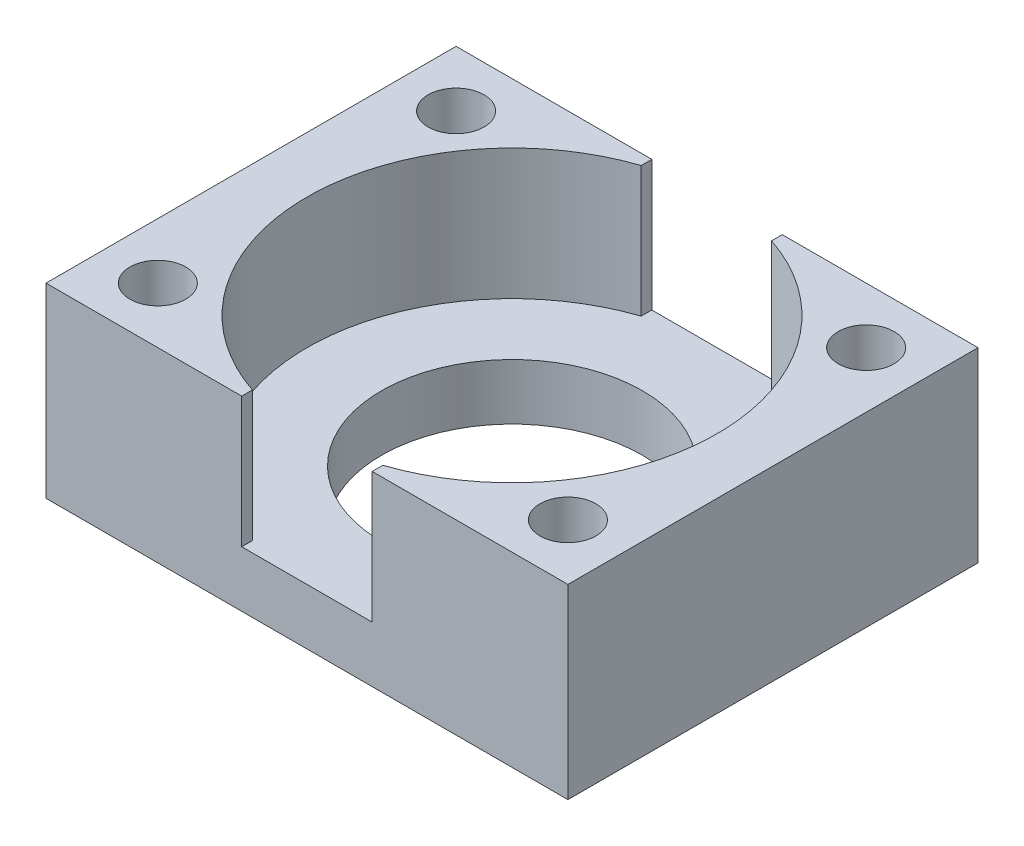
from build123d import *

# Parameters (mm, degrees)
SKETCH1_W           = 28
SKETCH1_H           = 22
BOSS_EXTRUDE1_DEPTH = 10
SKETCH5_W           = 7
SKETCH5_H           = 7
CUT_EXTRUDE7_DEPTH  = 22
SKETCH2_R           = 11
CUT_EXTRUDE8_DEPTH  = 7
SKETCH6_R           = 7
CUT_EXTRUDE9_DEPTH  = 3
SKETCH7_R           = 1.5
CUT_EXTRUDE10_DEPTH = 10


with BuildPart() as part:
    # Sketch1 → Boss-Extrude1 (new body)
    with BuildSketch(Plane(origin=(0, 0, 0), x_dir=(1, 0, 0), z_dir=(0, 1, 0))):
        Rectangle(SKETCH1_W, SKETCH1_H)
    extrude(amount=BOSS_EXTRUDE1_DEPTH)

    # Sketch5 → Cut-Extrude7 (cut)
    with BuildSketch(Plane(origin=(0, 0, -11), x_dir=(-1, 0, 0), z_dir=(0, 0, -1))):
        with Locations((0, 6.5)):
            Rectangle(SKETCH5_W, SKETCH5_H)
    extrude(amount=-CUT_EXTRUDE7_DEPTH, mode=Mode.SUBTRACT)

    # Sketch2 → Cut-Extrude8 (cut)
    with BuildSketch(Plane(origin=(0, 10, 0), x_dir=(1, 0, 0), z_dir=(0, 1, 0))):
        Circle(SKETCH2_R)
    extrude(amount=-CUT_EXTRUDE8_DEPTH, mode=Mode.SUBTRACT)

    # Sketch6 → Cut-Extrude9 (cut)
    with BuildSketch(Plane.XZ):
        with Locations(Location((0, 0, 0), (0, 0, 270))):
            Circle(SKETCH6_R)
    extrude(amount=-CUT_EXTRUDE9_DEPTH, mode=Mode.SUBTRACT)

    # Sketch7 → Cut-Extrude10 (cut)
    with BuildSketch(Plane.XZ):
        with Locations(Location((11, 8, 0), (0, 0, 270))):
            Circle(SKETCH7_R)
        with Locations(Location((11, -8, 0), (0, 0, 90))):
            Circle(SKETCH7_R)
        with Locations(Location((-11, -8, 0), (0, 0, 270))):
            Circle(SKETCH7_R)
        with Locations(Location((-11, 8, 0), (0, 0, 90))):
            Circle(SKETCH7_R)
    extrude(amount=-CUT_EXTRUDE10_DEPTH, mode=Mode.SUBTRACT)


solid = part.part
